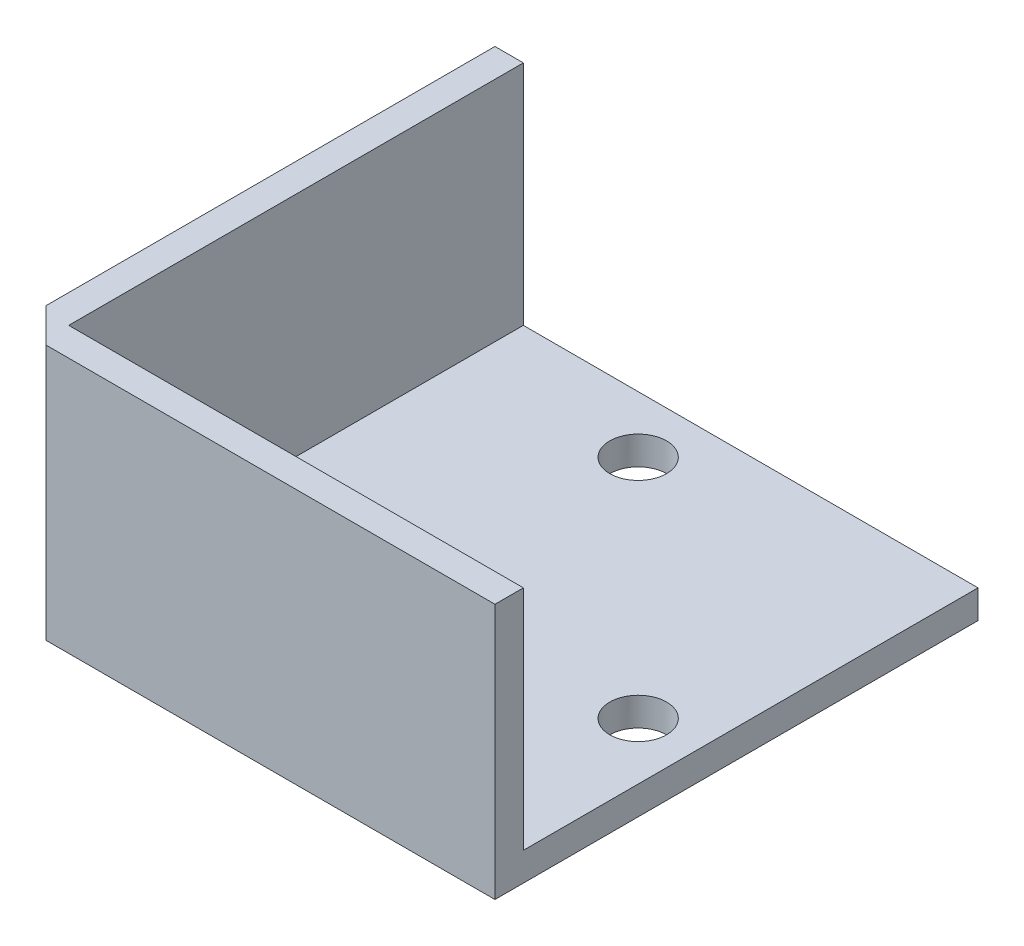
from build123d import *

# Parameters (mm, degrees)
SKETCH1_W           = 53.975
SKETCH1_H           = 53.975
BOSS_EXTRUDE1_DEPTH = 3.175
SKETCH2_W           = 3.175
SKETCH2_H           = 50.8
SKETCH2_W_2         = 50.8
SKETCH2_H_2         = 3.175
BOSS_EXTRUDE2_DEPTH = 25.4
CHAMFER1_SIZE       = 3.81
SKETCH3_R           = 3.175
CUT_EXTRUDE1_DEPTH  = 25.4


with BuildPart() as part:
    # Sketch1 → Boss-Extrude1 (new body)
    with BuildSketch(Plane(origin=(0, 0, 0), x_dir=(1, 0, 0), z_dir=(0, 1, 0))):
        with Locations((26.9875, 26.9875)):
            Rectangle(SKETCH1_W, SKETCH1_H)
    extrude(amount=BOSS_EXTRUDE1_DEPTH)

    # Sketch2 → Boss-Extrude2 (add)
    with BuildSketch(Plane(origin=(0, 3.175, 0), x_dir=(1, 0, 0), z_dir=(0, 1, 0))):
        with Locations((1.5875, 28.575)):
            Rectangle(SKETCH2_W, SKETCH2_H)
        with Locations((28.575, 1.5875)):
            Rectangle(SKETCH2_W_2, SKETCH2_H_2)
        with Locations((1.5875, 1.5875)):
            Rectangle(SKETCH2_W, SKETCH2_H_2)
    extrude(amount=BOSS_EXTRUDE2_DEPTH)

    # Chamfer1
    chamfer1_edges = [part.edges().sort_by_distance(p)[0] for p in [
        (0, 14.2875, 0),
    ]]
    chamfer(chamfer1_edges, length=CHAMFER1_SIZE)

    # Sketch3 → Cut-Extrude1 (cut)
    with BuildSketch(Plane(origin=(0, 3.175, 0), x_dir=(1, 0, 0), z_dir=(0, 1, 0))):
        with Locations(Location((22.352, 47.625, 0), (0, 0, 270))):
            Circle(SKETCH3_R)
        with Locations(Location((47.625, 22.352, 0), (0, 0, 270))):
            Circle(SKETCH3_R)
    extrude(amount=-CUT_EXTRUDE1_DEPTH, mode=Mode.SUBTRACT)


solid = part.part
